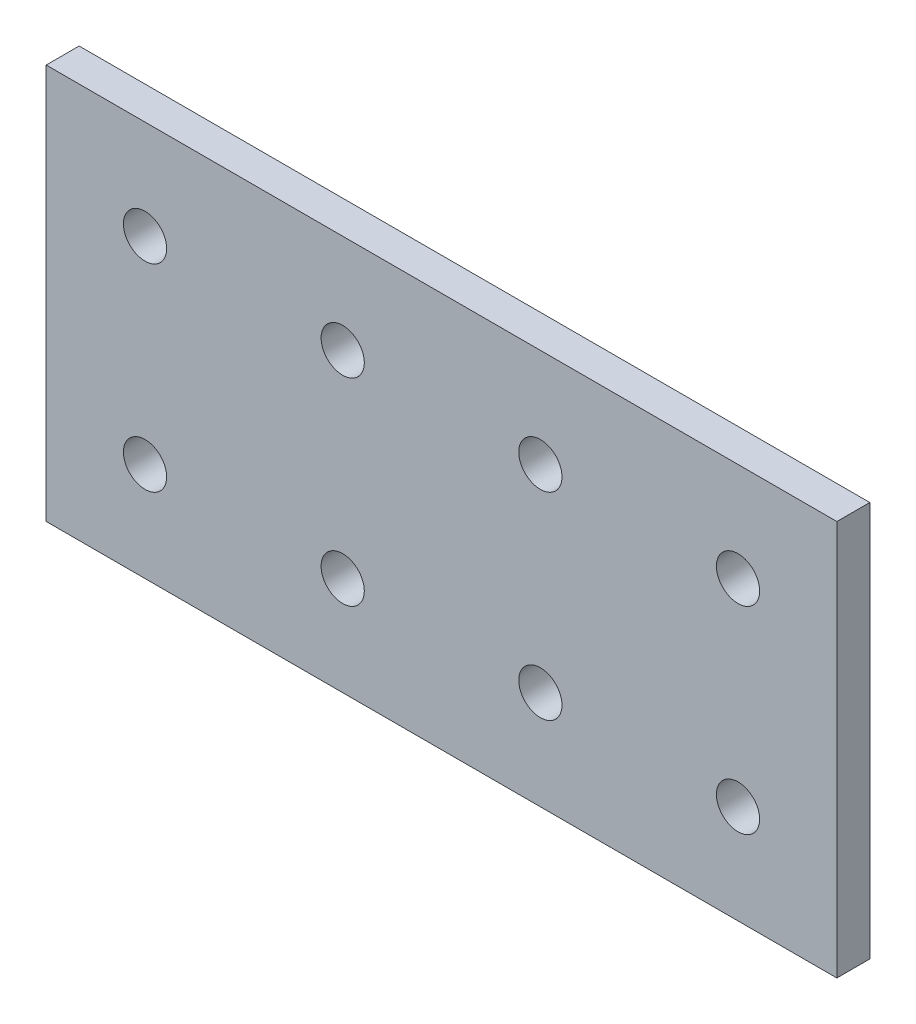
from build123d import *

# Parameters (mm, degrees)
SKETCH1_W           = 152.4
SKETCH1_H           = 76.2
SKETCH1_R           = 4.1656
BOSS_EXTRUDE1_DEPTH = 3.175


with BuildPart() as part:
    # Sketch1 → Boss-Extrude1 (new, symmetric)
    with BuildSketch(Plane.XY):
        with Locations((76.2, 38.1)):
            Rectangle(SKETCH1_W, SKETCH1_H)
        with Locations((19.05, 19.05)):
            Circle(SKETCH1_R, mode=Mode.SUBTRACT)
        with Locations((57.15, 19.05)):
            Circle(SKETCH1_R, mode=Mode.SUBTRACT)
        with Locations((95.25, 19.05)):
            Circle(SKETCH1_R, mode=Mode.SUBTRACT)
        with Locations((133.35, 19.05)):
            Circle(SKETCH1_R, mode=Mode.SUBTRACT)
        with Locations((19.05, 57.15)):
            Circle(SKETCH1_R, mode=Mode.SUBTRACT)
        with Locations((57.15, 57.15)):
            Circle(SKETCH1_R, mode=Mode.SUBTRACT)
        with Locations((95.25, 57.15)):
            Circle(SKETCH1_R, mode=Mode.SUBTRACT)
        with Locations((133.35, 57.15)):
            Circle(SKETCH1_R, mode=Mode.SUBTRACT)
    extrude(amount=BOSS_EXTRUDE1_DEPTH, both=True)


solid = part.part
